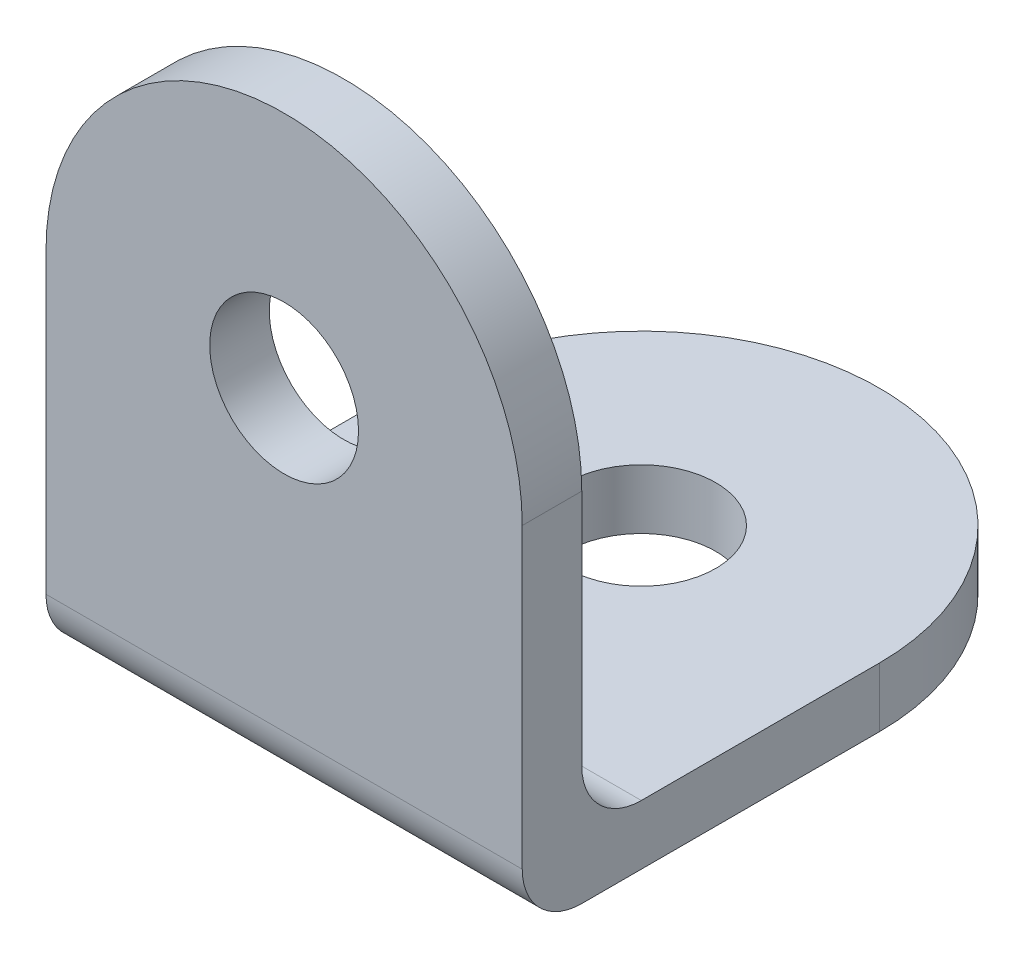
from build123d import *

# Parameters (mm, degrees)
SKETCH_2_R      = 2.5
EXTRUDE_1_DEPTH = 2
SKETCH_3_R      = 2.5
EXTRUDE_2_DEPTH = 2
FILLET_1_R      = 2


with BuildPart() as part:
    # 草图2 → 凸台-拉伸1 (new body)
    with BuildSketch(Plane(origin=(0, 0, 0), x_dir=(1, 0, 0), z_dir=(0, 1, 0))):
        with BuildLine():
            Line((0, 0), (16, 0))
            Line((16, 0), (16, 12))
            ThreePointArc((16, 12), (8, 20), (0, 12))
            Line((0, 12), (0, 0))
        make_face()
        with Locations(Location((8, 12, 0), (0, 0, 270))):
            Circle(SKETCH_2_R, mode=Mode.SUBTRACT)
    extrude(amount=EXTRUDE_1_DEPTH)

    # 草图3 → 凸台-拉伸2 (add)
    with BuildSketch(Plane.XY):
        with BuildLine():
            Line((0, 0), (16, 0))
            Line((16, 0), (16, 12))
            ThreePointArc((16, 12), (8, 20), (0, 12))
            Line((0, 12), (0, 0))
        make_face()
        with Locations((8, 12)):
            Circle(SKETCH_3_R, mode=Mode.SUBTRACT)
    extrude(amount=-EXTRUDE_2_DEPTH)

    # 圆角1
    fillet_1_edges = [part.edges().sort_by_distance(p)[0] for p in [
        (8, 2, -2),
        (8, 0, 0),
    ]]
    fillet(fillet_1_edges, radius=FILLET_1_R)


solid = part.part
